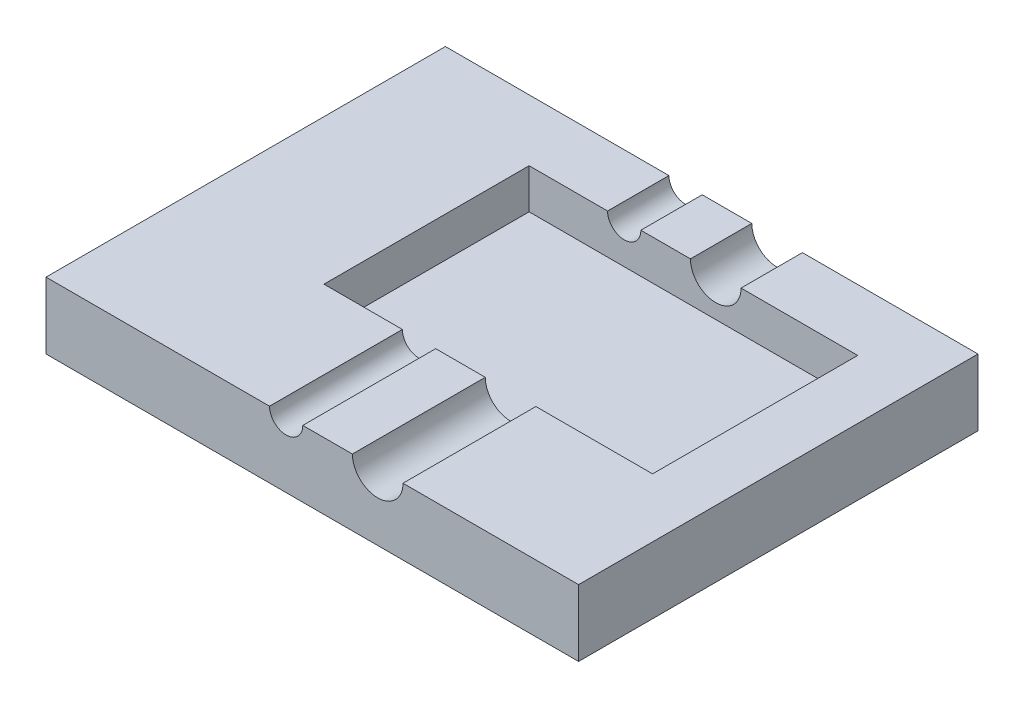
from build123d import *

# Parameters (mm, degrees)
SKETCH1_W           = 101.6
SKETCH1_H           = 76.2
BOSS_EXTRUDE1_DEPTH = 12.7
SKETCH4_W           = 62.685063192
SKETCH4_H           = 39.138657103
CUT_EXTRUDE2_DEPTH  = 7.62
SKETCH5_R           = 3.175
SKETCH5_R_2         = 4.826
CUT_EXTRUDE3_DEPTH  = 93.457395594


with BuildPart() as part:
    # Sketch1 → Boss-Extrude1 (new body)
    with BuildSketch(Plane(origin=(0, 0, 0), x_dir=(1, 0, 0), z_dir=(0, 1, 0))):
        with Locations((0, 30.062025316)):
            Rectangle(SKETCH1_W, SKETCH1_H)
    extrude(amount=BOSS_EXTRUDE1_DEPTH)

    # Sketch4 → Cut-Extrude2 (cut)
    with BuildSketch(Plane(origin=(0, 12.7, 0), x_dir=(1, 0, 0), z_dir=(0, 1, 0))):
        with Locations((8.217537696, 36.883635135)):
            Rectangle(SKETCH4_W, SKETCH4_H)
    extrude(amount=-CUT_EXTRUDE2_DEPTH, mode=Mode.SUBTRACT)

    # Sketch5 → Cut-Extrude3 (cut, through all)
    with BuildSketch(Plane.XY.offset(8.037974684)):
        with Locations((-4.986623509, 12.7)):
            Circle(SKETCH5_R)
        with Locations((12.475876491, 12.7)):
            Circle(SKETCH5_R_2)
    extrude(amount=-CUT_EXTRUDE3_DEPTH, mode=Mode.SUBTRACT)


solid = part.part
